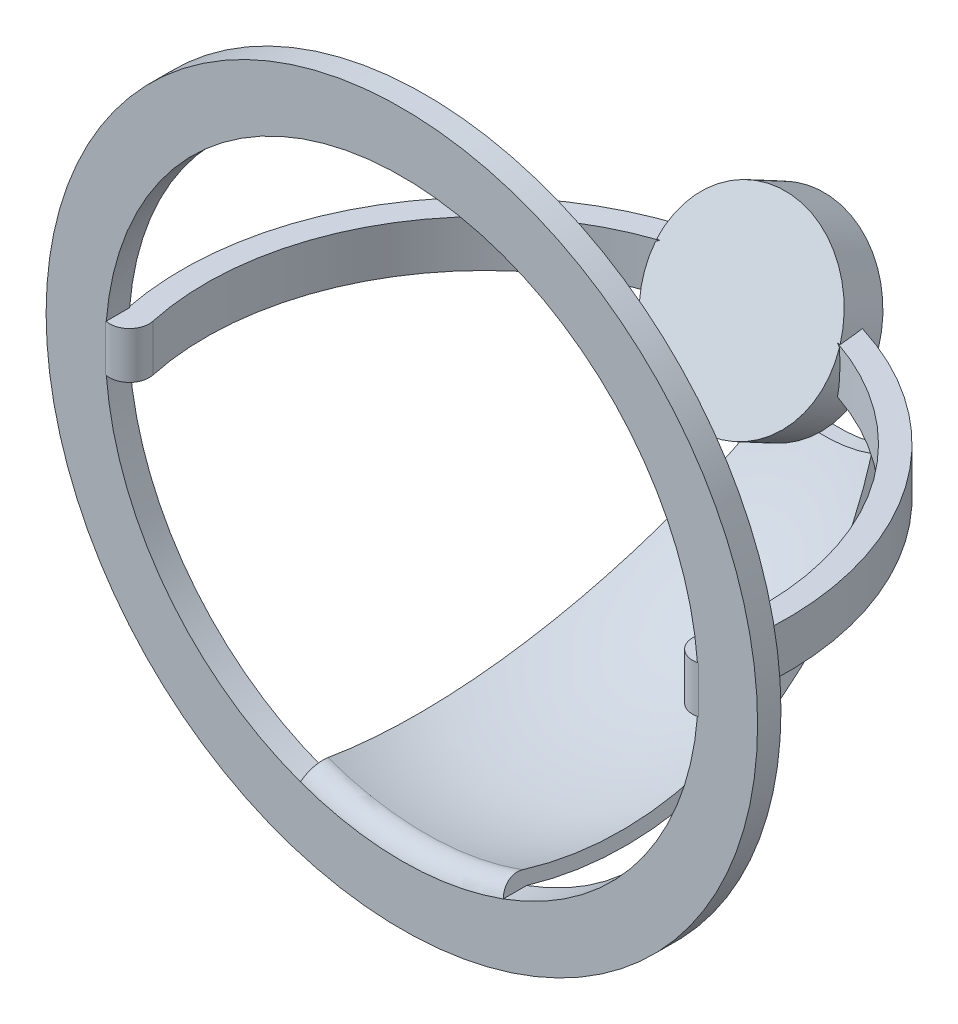
from build123d import *
from build123d.topology import SkipClean

# Parameters (mm, degrees)
SKETCH1_R                = 15.24
SKETCH1_R_2              = 12.7
BOSS_EXTRUDE1_DEPTH      = 1
BOSS_EXTRUDE2_DEPTH      = 1
BOSS_EXTRUDE2_DEPTH_BACK = 1
BOSS_EXTRUDE3_DEPTH      = 0.941652
BOSS_EXTRUDE3_DEPTH_BACK = 0.941653
SKETCH3_R                = 3.975036
REVOLVE1_ANGLE           = 20
REVOLVE1_OTHER_WAY_ANGLE = 20


with BuildPart() as part:
    # Sketch1 → Boss-Extrude1 (new body)
    with BuildSketch(Plane.XY):
        Circle(SKETCH1_R)
        Circle(SKETCH1_R_2, mode=Mode.SUBTRACT)
    extrude(amount=BOSS_EXTRUDE1_DEPTH)

    # Sketch2 → Boss-Extrude2 (add, two sides: drawn at the far end of the back side and taken through both)
    with BuildSketch(Plane(origin=(0, 0, 0), x_dir=(1, 0, 0), z_dir=(0, 1, 0)).offset(-BOSS_EXTRUDE2_DEPTH_BACK)):
        with BuildLine():
            Line((-12.7, -1), (-12.7, 0))
            ThreePointArc((-12.7, 0), (-11.125866, 9.169985), (-3.81, 14.918429))
            Line((-3.81, 14.918429), (-3.81, 13.851069))
            ThreePointArc((-3.81, 13.851069), (-10.383139, 8.426155), (-11.662109, 0))
            ThreePointArc((-11.662109, 0), (-11.901887, -0.789745), (-12.7, -1))
        make_face()
        with BuildLine():
            Line((12.7, 0), (12.7, -1))
            ThreePointArc((12.7, -1), (11.901887, -0.789745), (11.662109, 0))
            ThreePointArc((11.662109, 0), (10.383139, 8.426155), (3.81, 13.851069))
            Line((3.81, 13.851069), (3.81, 14.918429))
            ThreePointArc((3.81, 14.918429), (11.125866, 9.169985), (12.7, 0))
        make_face()
    extrude(amount=BOSS_EXTRUDE2_DEPTH + BOSS_EXTRUDE2_DEPTH_BACK)

    # Sketch3 → Boss-Extrude3 (add, two sides: drawn at the far end of the back side and taken through both)
    with BuildSketch(Plane(origin=(0, -5.975066, -11.195977), x_dir=(1, 0, 0), z_dir=(0, 0.47082616425374885, 0.8822260045215751)).offset(-BOSS_EXTRUDE3_DEPTH_BACK)):
        with Locations(Location((0, 6.772716, 0), (0, 0, 163.431963))):
            Circle(SKETCH3_R)
    extrude(amount=BOSS_EXTRUDE3_DEPTH + BOSS_EXTRUDE3_DEPTH_BACK)

    # Sketch4 → Revolve1 (revolve)
    with SkipClean():  # the faces are left unmerged after this step: merging them gives an invalid solid
        with BuildSketch(Plane(origin=(0, 0, 0), x_dir=(0, 0, -1), z_dir=(1, 0, 0))):
            with BuildLine():
                Line((17.08705, -5.966909), (17.705017, -5.966909))
                ThreePointArc((17.705017, -5.966909), (9.916748, -12.131929), (0, -12.7))
                Line((0, -12.7), (-1, -12.7))
                ThreePointArc((-1, -12.7), (-0.601796, -12.243641), (0, -12.1753))
                ThreePointArc((0, -12.1753), (9.513236, -11.739993), (17.08705, -5.966909))
            make_face()
        revolve(axis=Axis((0, 0, 0), (0, 0, -1)), revolution_arc=REVOLVE1_ANGLE)

    # Sketch4 → Revolve1 other way (revolve)
    with SkipClean():  # the faces are left unmerged after this step: merging them gives an invalid solid
        with BuildSketch(Plane(origin=(0, 0, 0), x_dir=(0, 0, -1), z_dir=(1, 0, 0))):
            with BuildLine():
                Line((17.08705, -5.966909), (17.705017, -5.966909))
                ThreePointArc((17.705017, -5.966909), (9.916748, -12.131929), (0, -12.7))
                Line((0, -12.7), (-1, -12.7))
                ThreePointArc((-1, -12.7), (-0.601796, -12.243641), (0, -12.1753))
                ThreePointArc((0, -12.1753), (9.513236, -11.739993), (17.08705, -5.966909))
            make_face()
        revolve(axis=Axis((0, 0, 0), (0, 0, 1)), revolution_arc=REVOLVE1_OTHER_WAY_ANGLE)


solid = part.part
